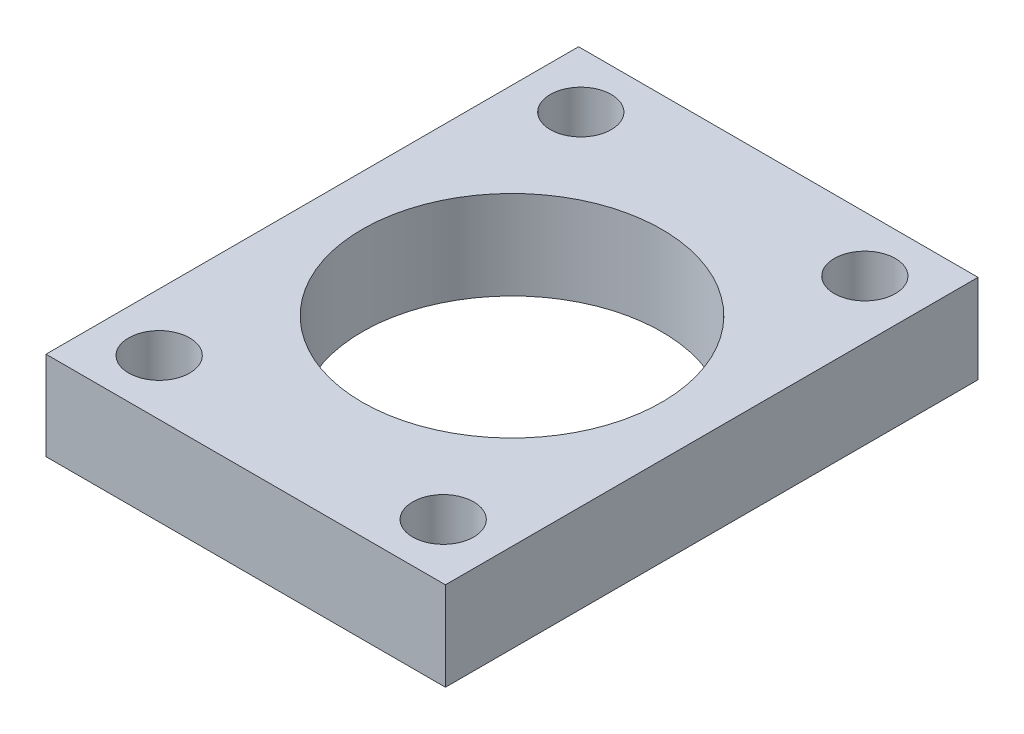
from build123d import *

# Parameters (mm, degrees)
SKETCH1_W                = 57.15
SKETCH1_H                = 76.2
EXTRUDE1_DEPTH           = 12.7
SKETCH9_R                = 21.43125
CUT_EXTRUDE1_DEPTH       = 50.289254661
F_5_16_CLEARANCE_HOLE1_D = 8.72998


with BuildPart() as part:
    # Sketch1 → Extrude1 (new body)
    with BuildSketch(Plane(origin=(0, 0, 0), x_dir=(1, 0, 0), z_dir=(0, 1, 0))):
        Rectangle(SKETCH1_W, SKETCH1_H)
    extrude(amount=EXTRUDE1_DEPTH)

    # Sketch9 → Cut-Extrude1 (cut, through all)
    with BuildSketch(Plane(origin=(0, 12.7, 0), x_dir=(-1, 0, 0), z_dir=(0, 1, 0))):
        with Locations(Location((0, 0, 0), (0, 0, 90))):
            Circle(SKETCH9_R)
    extrude(amount=-CUT_EXTRUDE1_DEPTH, mode=Mode.SUBTRACT)

    # 5/16 Clearance Hole1 (through all)
    with Locations(Plane(origin=(0, 12.7, 0), x_dir=(-1, 0, 0), z_dir=(0, 1, 0))):
        with Locations((20.32, -30.1625), (-20.32, -30.1625), (-20.32, 30.1625), (20.32, 30.1625)):
            Hole(F_5_16_CLEARANCE_HOLE1_D / 2)


solid = part.part
